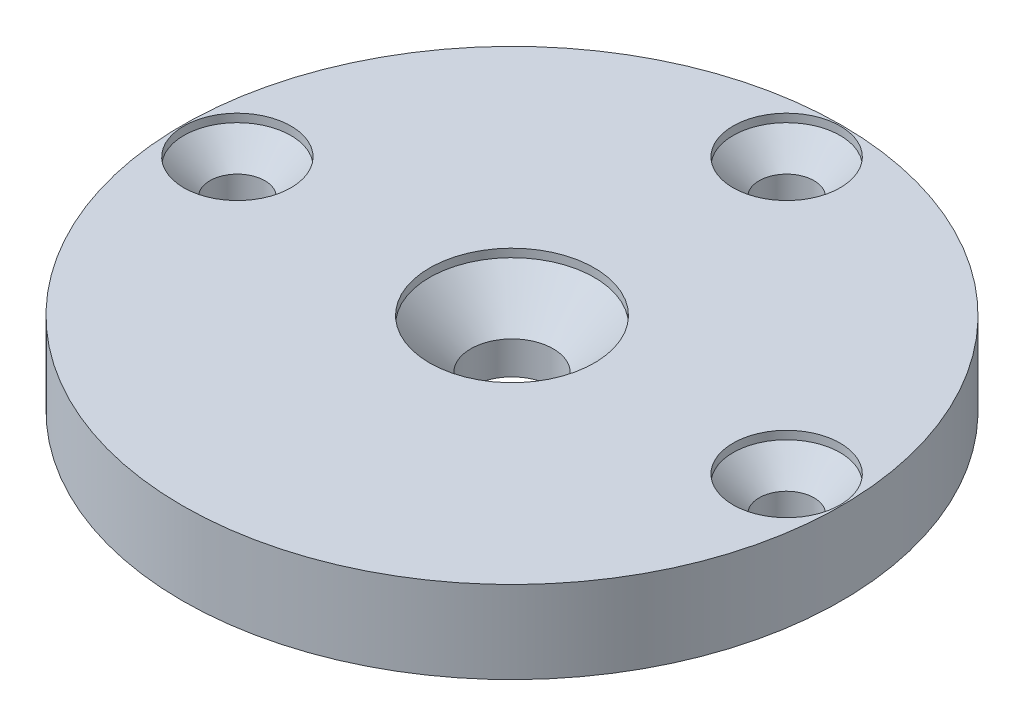
from build123d import *

# Parameters (mm, degrees)
SKETCH1_R                                      = 12
SKETCH1_R_2                                    = 1.5
SKETCH1_R_3                                    = 1
BOSS_EXTRUDE1_DEPTH                            = 3
CSK_FOR_M2_FLAT_HEAD_MACHINE_SCREW1_AT_2_COUNT = 2
CSK_FOR_M2_FLAT_HEAD_MACHINE_SCREW1_AT_2_PITCH = 14.142135624
CSK_FOR_M2_FLAT_HEAD_MACHINE_SCREW1_AT_3_COUNT = 2
CSK_FOR_M2_FLAT_HEAD_MACHINE_SCREW1_AT_3_PITCH = 20


with BuildPart() as part:
    # Sketch1 → Boss-Extrude1 (new body)
    with BuildSketch(Plane(origin=(0, 0, 0), x_dir=(1, 0, 0), z_dir=(0, 1, 0))):
        with Locations(Location((0, 0, 0), (0, 0, 270))):
            Circle(SKETCH1_R)
        with Locations(Location((0, 0, 0), (0, 0, 270))):
            Circle(SKETCH1_R_2, mode=Mode.SUBTRACT)
        with Locations(Location((-10, 0, 0), (0, 0, 270))):
            Circle(SKETCH1_R_3, mode=Mode.SUBTRACT)
        with Locations(Location((0, 10, 0), (0, 0, 270))):
            Circle(SKETCH1_R_3, mode=Mode.SUBTRACT)
        with Locations(Location((10, 0, 0), (0, 0, 270))):
            Circle(SKETCH1_R_3, mode=Mode.SUBTRACT)
    extrude(amount=BOSS_EXTRUDE1_DEPTH)

    # Sketch3 → CSK for M2 Flat Head Machine Screw1 (revolve, cut)
    with BuildSketch(Plane(origin=(-10, 3, 0), x_dir=(0, 0, 1), z_dir=(1, 0, 0))):
        Polygon((0, 0), (0, 5.600860619), (1, 5), (1, 1.25), (1.95, 0.3), (1.95, 0), align=None)
    csk_for_m2_flat_head_machine_screw1 = revolve(axis=Axis((-10, 9.35, 0), (0, -1, 0)), mode=Mode.SUBTRACT)

    # CSK for M2 Flat Head Machine Screw1 at 2: CSK for M2 Flat Head Machine Screw1 ×2
    with Locations(*[Vector(0.7071067811865476, 0, -0.7071067811865476) * (i * CSK_FOR_M2_FLAT_HEAD_MACHINE_SCREW1_AT_2_PITCH) for i in range(1, CSK_FOR_M2_FLAT_HEAD_MACHINE_SCREW1_AT_2_COUNT)]):
        add(csk_for_m2_flat_head_machine_screw1, mode=Mode.SUBTRACT)

    # CSK for M2 Flat Head Machine Screw1 at 3: CSK for M2 Flat Head Machine Screw1 ×2
    with Locations(*[(i * CSK_FOR_M2_FLAT_HEAD_MACHINE_SCREW1_AT_3_PITCH, 0, 0) for i in range(1, CSK_FOR_M2_FLAT_HEAD_MACHINE_SCREW1_AT_3_COUNT)]):
        add(csk_for_m2_flat_head_machine_screw1, mode=Mode.SUBTRACT)

    # Sketch5 → CSK for M3 Flat Head Machine Screw1 (revolve, cut)
    with BuildSketch(Plane(origin=(0, 3, 0), x_dir=(0, 0, 1), z_dir=(1, 0, 0))):
        Polygon((0, 0), (0, 5.901290929), (1.5, 5), (1.5, 1.8), (3, 0.3), (3, 0), align=None)
    revolve(axis=Axis((0, 9.35, 0), (0, -1, 0)), mode=Mode.SUBTRACT)


solid = part.part
